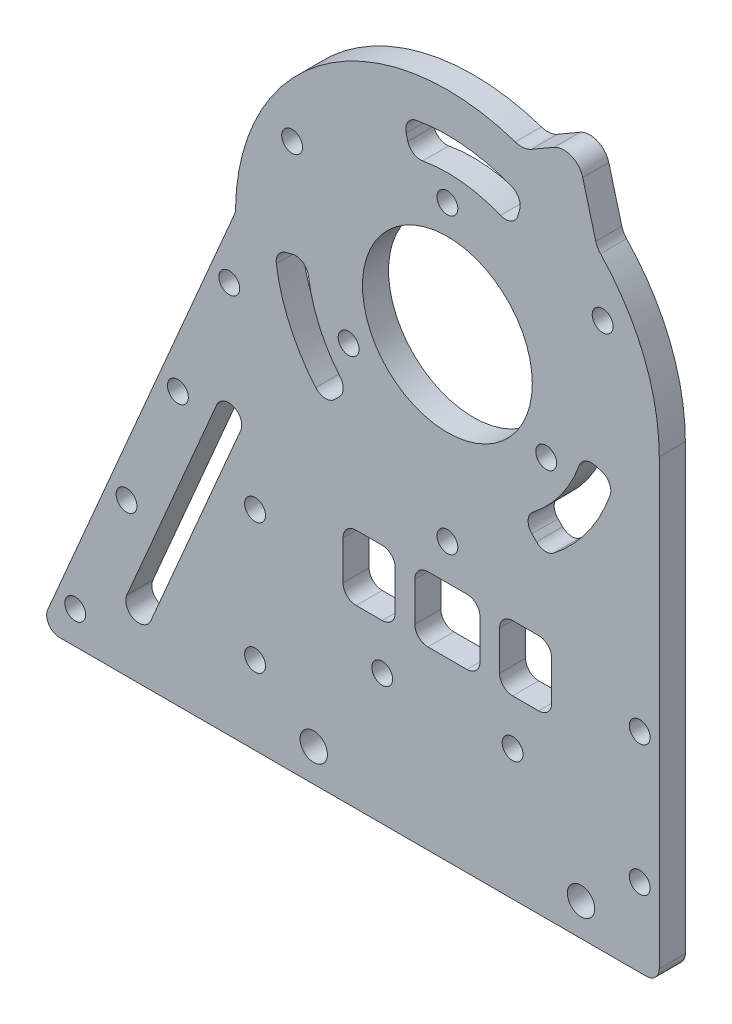
from build123d import *

# Parameters (mm, degrees)
SKETCH_1_R          = 32.5
SKETCH_1_R_2        = 13.025
EXTRUDE_1_DEPTH     = 4
EXTRUDE_START       = -4
EXTRUDE_2_DEPTH     = 4
SKETCH_4_R          = 1.6
CUT_EXTRUDE_1_DEPTH = 4
SKETCH_5_R          = 2.1
CUT_EXTRUDE_2_DEPTH = 4
SKETCH_6_R          = 1.6
CUT_EXTRUDE_3_DEPTH = 10
SKETCH_7_W          = 10
SKETCH_7_H          = 10
SKETCH_7_W_2        = 8
CUT_EXTRUDE_4_DEPTH = 10
FILLET_2_R          = 2
SKETCH_8_R          = 1.6
CUT_EXTRUDE_5_DEPTH = 10
EXTRUDE_4_DEPTH     = 4
FILLET_3_R          = 3
EXTRUDE_5_DEPTH     = 4
FILLET_4_R          = 2
CUT_EXTRUDE_6_DEPTH = 17
FILLET_5_R          = 2
SKETCH_14_R         = 1.6
CUT_EXTRUDE_7_DEPTH = 17
SKETCH_15_R         = 1.6
CUT_EXTRUDE_8_DEPTH = 10


with BuildPart() as part:
    # 草图1 → 凸台-拉伸1 (new body)
    with BuildSketch(Plane.XY):
        Circle(SKETCH_1_R)
        Circle(SKETCH_1_R_2, mode=Mode.SUBTRACT)
    extrude(amount=EXTRUDE_1_DEPTH)

    # 草图2 → 凸台-拉伸2 (add)
    with BuildSketch(Plane.XY.offset(4).offset(EXTRUDE_START)):
        with BuildLine():
            Line((-32.5, 0), (-32.5, -70))
            Line((-32.5, -70), (32.5, -70))
            Line((32.5, -70), (32.5, 0))
            ThreePointArc((32.5, 0), (0, -32.5), (-32.5, 0))
        make_face()
    extrude(amount=EXTRUDE_2_DEPTH)

    # 草图4 → 切除-拉伸1 (cut)
    with BuildSketch(Plane.XY.offset(4)):
        with Locations((0, 17.5)):
            Circle(SKETCH_4_R)
        with Locations((15.155444566, -8.75)):
            Circle(SKETCH_4_R)
        with Locations((-15.155444566, -8.75)):
            Circle(SKETCH_4_R)
    extrude(amount=-CUT_EXTRUDE_1_DEPTH, mode=Mode.SUBTRACT)

    # 草图5 → 切除-拉伸2 (cut)
    with BuildSketch(Plane.XY.offset(4)):
        with Locations((-20.5, -65)):
            Circle(SKETCH_5_R)
        with Locations((20.5, -65)):
            Circle(SKETCH_5_R)
    extrude(amount=-CUT_EXTRUDE_2_DEPTH, mode=Mode.SUBTRACT)

    # 草图6 → 切除-拉伸3 (cut)
    with BuildSketch(Plane(origin=(0, 0, 0), x_dir=(-1, 0, 0), z_dir=(0, 0, -1))):
        with Locations((-10, -50)):
            Circle(SKETCH_6_R)
        with Locations((10, -50)):
            Circle(SKETCH_6_R)
    extrude(amount=-CUT_EXTRUDE_3_DEPTH, mode=Mode.SUBTRACT)

    # 草图7 → 切除-拉伸4 (cut)
    with BuildSketch(Plane(origin=(0, 0, 0), x_dir=(-1, 0, 0), z_dir=(0, 0, -1))):
        with Locations((0, -38)):
            Rectangle(SKETCH_7_W, SKETCH_7_H)
        with Locations((12, -38)):
            Rectangle(SKETCH_7_W_2, SKETCH_7_H)
        with Locations((-12, -38)):
            Rectangle(SKETCH_7_W_2, SKETCH_7_H)
    extrude(amount=-CUT_EXTRUDE_4_DEPTH, mode=Mode.SUBTRACT)

    # 圆角2
    fillet_2_edges = [part.edges().sort_by_distance(p)[0] for p in [
        (32.5, -70, 2),
        (-8, -43, 2),
        (-8, -33, 2),
        (-16, -33, 2),
        (-16, -43, 2),
        (16, -43, 2),
        (16, -33, 2),
        (8, -33, 2),
        (8, -43, 2),
        (5, -43, 2),
        (5, -33, 2),
        (-5, -33, 2),
        (-5, -43, 2),
    ]]
    fillet(fillet_2_edges, radius=FILLET_2_R)

    # 草图8 → 切除-拉伸5 (cut)
    with BuildSketch(Plane.XY.offset(4)):
        with Locations((29.5, -58)):
            Circle(SKETCH_8_R)
        with Locations((29.5, -38)):
            Circle(SKETCH_8_R)
        with Locations((-29.5, -38)):
            Circle(SKETCH_8_R)
        with Locations((-29.5, -58)):
            Circle(SKETCH_8_R)
    extrude(amount=-CUT_EXTRUDE_5_DEPTH, mode=Mode.SUBTRACT)

    # 草图9 → 凸台-拉伸4 (add)
    with BuildSketch(Plane.XY.offset(4).offset(EXTRUDE_START)):
        with BuildLine():
            Line((11.665320616, 30.334308875), (19.746534697, 35))
            Line((19.746534697, 35), (22.961925006, 23))
            ThreePointArc((22.961925006, 23), (17.697727439, 27.258768194), (11.665320616, 30.334308875))
        make_face()
    extrude(amount=EXTRUDE_4_DEPTH)

    # 圆角3
    fillet_3_edges = [part.edges().sort_by_distance(p)[0] for p in [
        (22.961925006, 23, 2),
        (11.665320616, 30.334308875, 2),
        (19.746534697, 35, 2),
    ]]
    fillet(fillet_3_edges, radius=FILLET_3_R)

    # 草图11 → 凸台-拉伸5 (add)
    with BuildSketch(Plane(origin=(0, 0, 0), x_dir=(-1, 0, 0), z_dir=(0, 0, -1))):
        Polygon((32.5, 0), (62.5, -70), (32.5, -70), align=None)
    extrude(amount=-EXTRUDE_5_DEPTH)

    # 圆角4
    fillet_4_edges = [part.edges().sort_by_distance(p)[0] for p in [
        (-32.5, 0, 2),
        (-62.5, -70, 2),
    ]]
    fillet(fillet_4_edges, radius=FILLET_4_R)

    # 草图12 → 切除-拉伸6 (cut)
    with BuildSketch(Plane(origin=(0, 0, 0), x_dir=(-1, 0, 0), z_dir=(0, 0, -1))):
        with BuildLine():
            Line((-10.217621979, 18.916928955), (-11.540771679, 23.854990862))
            ThreePointArc((-11.540771679, 23.854990862), (-2.497822398, 26.38201818), (6.858704695, 25.597034397))
            Line((6.858704695, 25.597034397), (5.56460947, 20.767405265))
            ThreePointArc((5.56460947, 20.767405265), (-2.503736607, 21.353718716), (-10.217621979, 18.916928955))
        make_face()
        with BuildLine():
            Line((21.491352026, -0.609744277), (26.429413934, -1.932893978))
            ThreePointArc((26.429413934, -1.932893978), (24.096409146, -11.02783144), (18.738329701, -18.738329701))
            Line((18.738329701, -18.738329701), (15.202795796, -15.202795796))
            ThreePointArc((15.202795796, -15.202795796), (19.744731177, -8.508559852), (21.491352026, -0.609744277))
        make_face()
        with BuildLine():
            Line((-11.273730047, -18.307184678), (-14.888642254, -21.922096885))
            ThreePointArc((-14.888642254, -21.922096885), (-21.598586749, -15.354186741), (-25.597034397, -6.858704695))
            Line((-25.597034397, -6.858704695), (-20.767405265, -5.56460947))
            ThreePointArc((-20.767405265, -5.56460947), (-17.24099457, -12.845158864), (-11.273730047, -18.307184678))
        make_face()
    extrude(amount=-CUT_EXTRUDE_6_DEPTH, mode=Mode.SUBTRACT)

    # 圆角5
    fillet_5_edges = [part.edges().sort_by_distance(p)[0] for p in [
        (-15.202795796, -15.202795796, 2),
        (-21.491352026, -0.609744277, 2),
        (-26.429413934, -1.932893978, 2),
        (-18.738329701, -18.738329701, 2),
        (-5.56460947, 20.767405265, 2),
        (10.217621979, 18.916928955, 2),
        (11.540771679, 23.854990862, 2),
        (-6.858704695, 25.597034397, 2),
        (20.767405265, -5.56460947, 2),
        (11.273730047, -18.307184678, 2),
        (14.888642254, -21.922096885, 2),
        (25.597034397, -6.858704695, 2),
    ]]
    fillet(fillet_5_edges, radius=FILLET_5_R)

    # 草图14 → 切除-拉伸7 (cut)
    with BuildSketch(Plane(origin=(0, 0, 0), x_dir=(-1, 0, 0), z_dir=(0, 0, -1))):
        with Locations((33.458082183, -9.851298199)):
            Circle(SKETCH_14_R)
        with Locations((41.336468154, -28.234198799)):
            Circle(SKETCH_14_R)
        with Locations((49.214854126, -46.6170994)):
            Circle(SKETCH_14_R)
        with Locations((57.093240097, -65)):
            Circle(SKETCH_14_R)
        with BuildLine():
            Line((35.385724459, -27.042085352), (49.172899909, -59.212161403))
            ThreePointArc((49.172899909, -59.212161403), (48.122448446, -61.83829006), (45.496319789, -60.787838597))
            Line((45.496319789, -60.787838597), (31.709144338, -28.617762547))
            ThreePointArc((31.709144338, -28.617762547), (32.759595801, -25.991633889), (35.385724459, -27.042085352))
        make_face()
    extrude(amount=-CUT_EXTRUDE_7_DEPTH, mode=Mode.SUBTRACT)

    # 草图15 → 切除-拉伸8 (cut)
    with BuildSketch(Plane(origin=(0, 0, 0), x_dir=(-1, 0, 0), z_dir=(0, 0, -1))):
        with Locations((0, -27.5)):
            Circle(SKETCH_15_R)
        with Locations((-23.815698604, 13.75)):
            Circle(SKETCH_15_R)
        with Locations((23.815698604, 13.75)):
            Circle(SKETCH_15_R)
    extrude(amount=-CUT_EXTRUDE_8_DEPTH, mode=Mode.SUBTRACT)


solid = part.part
